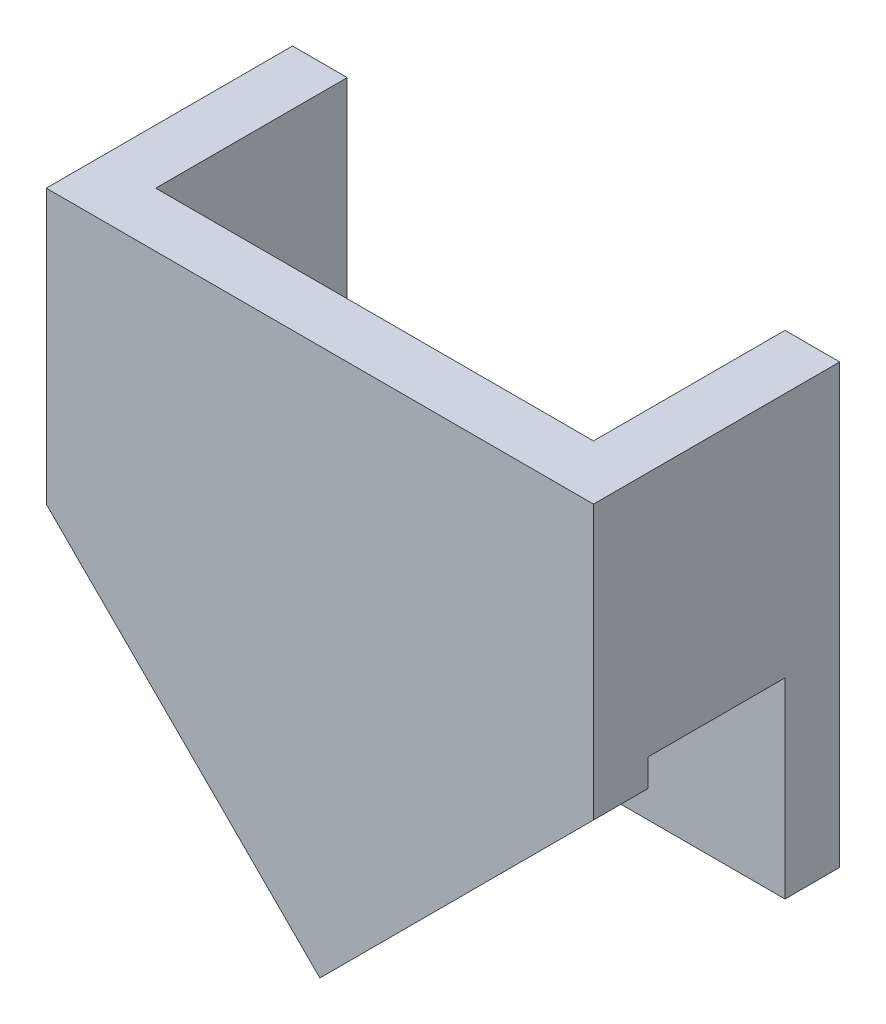
from build123d import *

# Parameters (mm, degrees)
BOSS_EXTRUDE1_DEPTH       = 100
CUT_EXTRUDE8_DEPTH        = 100
CUT_EXTRUDE8_DEPTH_BACK   = 100
SKETCH4_W                 = 25
SKETCH4_H                 = 55
CUT_EXTRUDE9_DEPTH        = 10
CUT_EXTRUDE10_DEPTH       = 10
SKETCH7_W                 = 80
SKETCH7_H                 = 65
BOSS_EXTRUDE2_DEPTH       = 10
SKETCH8_W                 = 100
SKETCH8_H                 = 20
CUT_EXTRUDE11_DEPTH       = 10
BOSS_EXTRUDE11_DEPTH      = 90
BOSS_EXTRUDE11_DEPTH_BACK = 10
SKETCH9_W                 = 25
SKETCH9_H                 = 15
CUT_EXTRUDE16_DEPTH       = 12.5
CUT_EXTRUDE16_DEPTH_BACK  = 12.5
SKETCH10_OUTSIDE_W        = 131.682
SKETCH10_OUTSIDE_H        = 131.682


with BuildPart() as part:
    # Sketch2 → Boss-Extrude1 (new body)
    with BuildSketch(Plane(origin=(0, 0, 0), x_dir=(1, 0, 0), z_dir=(0, 1, 0))):
        Polygon((-40, 22.5), (-40, -12.5), (40, -12.5), (40, 22.5), (50, 22.5), (50, -22.5), (-50, -22.5), (-50, 22.5), align=None)
    extrude(amount=BOSS_EXTRUDE1_DEPTH)

    # Sketch4 → Cut-Extrude8 (cut, two sides: drawn at the far end of the back side and taken through both)
    with BuildSketch(Plane(origin=(0, 0, 0), x_dir=(0, 0, -1), z_dir=(1, 0, 0)).offset(-CUT_EXTRUDE8_DEPTH_BACK)):
        with Locations((0, 27.5)):
            Rectangle(SKETCH4_W, SKETCH4_H)
    extrude(amount=CUT_EXTRUDE8_DEPTH + CUT_EXTRUDE8_DEPTH_BACK, mode=Mode.SUBTRACT)

    # Sketch5 → Cut-Extrude9 (cut)
    with BuildSketch(Plane.XY.offset(22.5)):
        Polygon((-50, 50), (0, 0), (-50, 0), align=None)
    extrude(amount=-CUT_EXTRUDE9_DEPTH, mode=Mode.SUBTRACT)

    # Sketch6 → Cut-Extrude10 (cut)
    with BuildSketch(Plane.XY.offset(22.5)):
        Polygon((0, 0), (50, 50), (50, 0), align=None)
    extrude(amount=-CUT_EXTRUDE10_DEPTH, mode=Mode.SUBTRACT)


with BuildPart() as body_2:
    # Sketch7 → Boss-Extrude2 (new body)
    with BuildSketch(Plane(origin=(0, 0, -22.5), x_dir=(-1, 0, 0), z_dir=(0, 0, -1))):
        with Locations((0, 32.5)):
            Rectangle(SKETCH7_W, SKETCH7_H)
    extrude(amount=-BOSS_EXTRUDE2_DEPTH)


with BuildPart() as cut_extrude11_tool:
    # Sketch8 → Cut-Extrude11 (new body)
    with BuildSketch(Plane(origin=(0, 0, -22.5), x_dir=(-1, 0, 0), z_dir=(0, 0, -1))):
        with Locations((0, 10)):
            Rectangle(SKETCH8_W, SKETCH8_H)
    extrude(amount=-CUT_EXTRUDE11_DEPTH)


with BuildPart() as part_1:
    add(part.part)

    # Cut-Extrude11: cut by cut_extrude11_tool
    add(cut_extrude11_tool.part, mode=Mode.SUBTRACT)



with BuildPart() as body_2_1:
    add(body_2.part)

    # Cut-Extrude11: cut by cut_extrude11_tool
    add(cut_extrude11_tool.part, mode=Mode.SUBTRACT)


with BuildPart() as part_2:
    add(part_1.part)

    add(body_2_1.part)  # Boss-Extrude11 merges body 2
    # Sketch9 → Boss-Extrude11 (add, two sides: drawn at the far end of the back side and taken through both)
    with BuildSketch(Plane(origin=(-40, 0, 0), x_dir=(0, 0, -1), z_dir=(1, 0, 0)).offset(-BOSS_EXTRUDE11_DEPTH_BACK)):
        with Locations((0, 57.5)):
            Rectangle(SKETCH9_W, SKETCH9_H)
    extrude(amount=BOSS_EXTRUDE11_DEPTH + BOSS_EXTRUDE11_DEPTH_BACK)

    # Sketch10 outside → Cut-Extrude16 (cut, two sides: drawn at the far end of the back side and taken through both)
    with BuildSketch(Plane.XY.offset(-CUT_EXTRUDE16_DEPTH_BACK)):
        with Locations((0, 50)):
            Rectangle(SKETCH10_OUTSIDE_W, SKETCH10_OUTSIDE_H)
        with BuildLine():
            Line((50, 55), (46.160254038, 55))
            ThreePointArc((46.160254038, 55), (37.5, 50), (28.839745962, 55))
            Line((28.839745962, 55), (-28.839745962, 55))
            ThreePointArc((-28.839745962, 55), (-37.5, 50), (-46.160254038, 55))
            Line((-46.160254038, 55), (-50, 55))
            Line((-50, 55), (-50, 100))
            Line((-50, 100), (-40, 100))
            Line((-40, 100), (-40, 65))
            Line((-40, 65), (40, 65))
            Line((40, 65), (40, 100))
            Line((40, 100), (50, 100))
            Line((50, 100), (50, 55))
        make_face(mode=Mode.SUBTRACT)
    extrude(amount=CUT_EXTRUDE16_DEPTH + CUT_EXTRUDE16_DEPTH_BACK, mode=Mode.SUBTRACT)


solid = part_2.part
